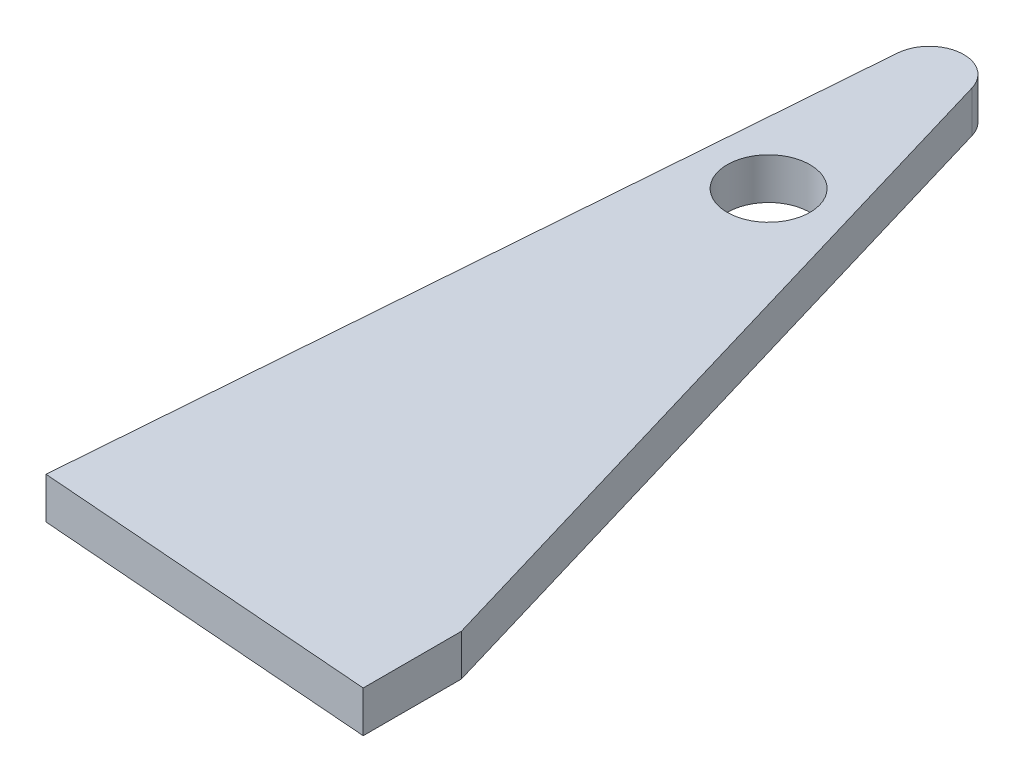
from build123d import *

# Parameters (mm, degrees)
SKETCH1_R           = 6
BOSS_EXTRUDE1_DEPTH = 6


with BuildPart() as part:
    # Sketch1 → Boss-Extrude1 (new body)
    with BuildSketch(Plane(origin=(0, 0, 0), x_dir=(1, 0, 0), z_dir=(0, 1, 0))):
        with BuildLine():
            Line((8.845195956, 114.659332409), (0, 0))
            Line((0, 0), (49.851883656, -3.845737372))
            Line((49.851883656, -3.845737372), (49.851883656, 10.382317327))
            Line((49.851883656, 10.382317327), (18.624081043, 115.696191659))
            ThreePointArc((18.624081043, 115.696191659), (13.303187452, 119.246887337), (8.845195956, 114.659332409))
        make_face()
        with Locations((16.515553245, 88.289115087)):
            Circle(SKETCH1_R, mode=Mode.SUBTRACT)
    extrude(amount=BOSS_EXTRUDE1_DEPTH)


solid = part.part
